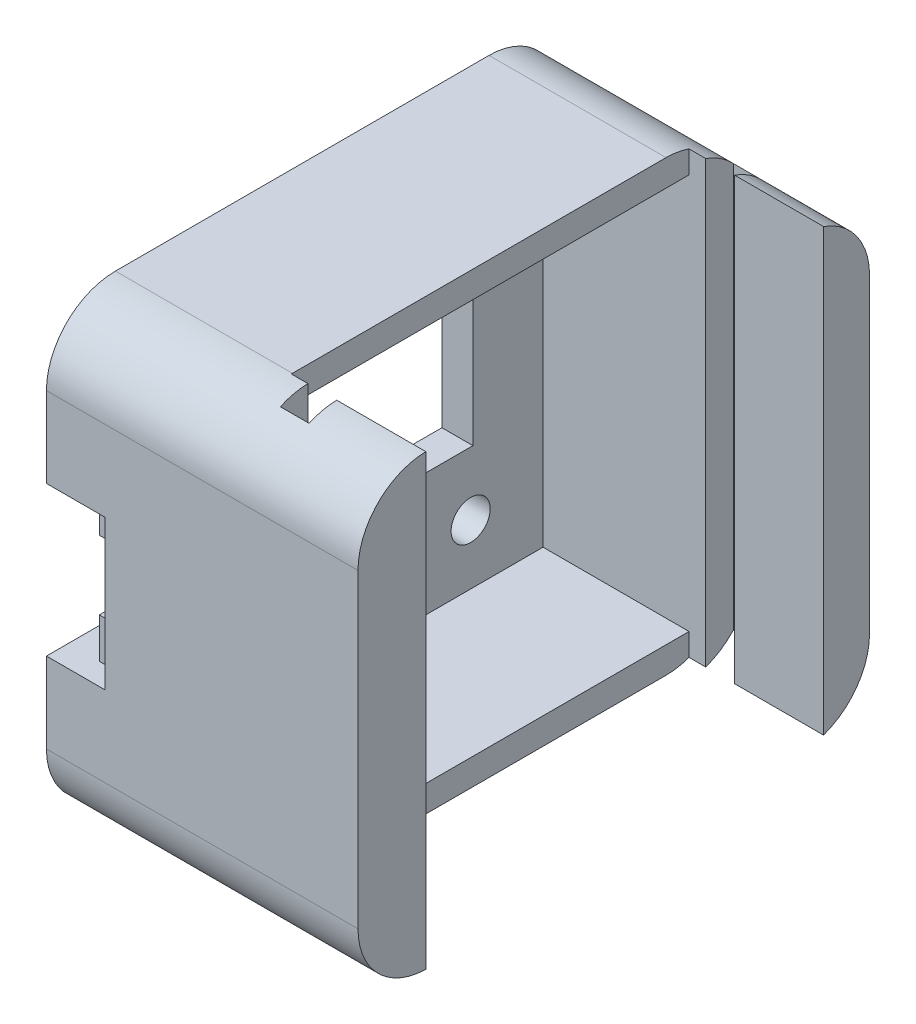
from build123d import *

# Parameters (mm, degrees)
SKETCH1_W           = 42.6
SKETCH1_H           = 39
BOSS_EXTRUDE1_DEPTH = 2.7
SKETCH2_W           = 42.6
SKETCH2_H           = 2.3
BOSS_EXTRUDE2_DEPTH = 12.7
SKETCH3_W           = 4
SKETCH3_H           = 39
BOSS_EXTRUDE3_DEPTH = 18.4
SKETCH4_R           = 1.7
SKETCH4_W           = 33.2
SKETCH4_H           = 13
CUT_EXTRUDE1_DEPTH  = 2.7
SKETCH5_W           = 4.7
SKETCH5_H           = 6
CUT_EXTRUDE2_DEPTH  = 2.4
SKETCH6_W           = 2.5
SKETCH6_H           = 2.4
CUT_EXTRUDE3_DEPTH  = 30
SKETCH7_W           = 5.9
SKETCH7_H           = 39
SKETCH7_W_2         = 4
BOSS_EXTRUDE4_DEPTH = 6
BOSS_EXTRUDE5_DEPTH = 1.9
CUT_EXTRUDE4_DEPTH  = 326.914559356


with BuildPart() as part:
    # Sketch1 → Boss-Extrude1 (new body)
    with BuildSketch(Plane(origin=(193.9, 0, 0), x_dir=(0, 0, -1), z_dir=(1, 0, 0))):
        with Locations((-301, 0)):
            Rectangle(SKETCH1_W, SKETCH1_H)
    extrude(amount=BOSS_EXTRUDE1_DEPTH)

    # Sketch2 → Boss-Extrude2 (add)
    with BuildSketch(Plane(origin=(196.6, 0, 0), x_dir=(0, 0, -1), z_dir=(1, 0, 0))):
        with Locations((-301, 18.35)):
            Rectangle(SKETCH2_W, SKETCH2_H)
        with Locations((-301, -18.35)):
            Rectangle(SKETCH2_W, SKETCH2_H)
    extrude(amount=BOSS_EXTRUDE2_DEPTH)

    # Sketch3 → Boss-Extrude3 (add)
    with BuildSketch(Plane(origin=(196.6, 0, 0), x_dir=(0, 0, -1), z_dir=(1, 0, 0))):
        with Locations((-320.3, 0)):
            Rectangle(SKETCH3_W, SKETCH3_H)
        with Locations((-281.7, 0)):
            Rectangle(SKETCH3_W, SKETCH3_H)
    extrude(amount=BOSS_EXTRUDE3_DEPTH)

    # Sketch4 → Cut-Extrude1 (cut)
    with BuildSketch(Plane(origin=(193.9, 0, 0), x_dir=(0, 0, -1), z_dir=(1, 0, 0))):
        with Locations(Location((-290, 12, 0), (0, 0, 180))):
            Circle(SKETCH4_R)
        with Locations(Location((-290, -12, 0), (0, 0, 180))):
            Circle(SKETCH4_R)
        with Locations(Location((-312, 12, 0), (0, 0, 180))):
            Circle(SKETCH4_R)
        with Locations(Location((-312, -12, 0), (0, 0, 180))):
            Circle(SKETCH4_R)
        with Locations((-306.4, 0)):
            Rectangle(SKETCH4_W, SKETCH4_H)
    extrude(amount=CUT_EXTRUDE1_DEPTH, mode=Mode.SUBTRACT)

    # Sketch5 → Cut-Extrude2 (cut)
    with BuildSketch(Plane(origin=(196.6, 0, 0), x_dir=(0, 0, -1), z_dir=(1, 0, 0))):
        with Locations((-320.65, 0)):
            Rectangle(SKETCH5_W, SKETCH5_H)
    extrude(amount=CUT_EXTRUDE2_DEPTH, mode=Mode.SUBTRACT)

    # Sketch6 → Cut-Extrude3 (cut, symmetric)
    with BuildSketch(Plane(origin=(0, 0, 0), x_dir=(1, 0, 0), z_dir=(0, 1, 0))):
        with Locations((212, -319.5)):
            Rectangle(SKETCH6_W, SKETCH6_H)
        with Locations((212, -282.5)):
            Rectangle(SKETCH6_W, SKETCH6_H)
    extrude(amount=CUT_EXTRUDE3_DEPTH, both=True, mode=Mode.SUBTRACT)

    # Sketch7 → Boss-Extrude4 (add)
    with BuildSketch(Plane(origin=(215, 0, 0), x_dir=(0, 0, -1), z_dir=(1, 0, 0))):
        with Locations((-321.25, 0)):
            Rectangle(SKETCH7_W, SKETCH7_H)
        with Locations((-281.7, 0)):
            Rectangle(SKETCH7_W_2, SKETCH7_H)
    extrude(amount=BOSS_EXTRUDE4_DEPTH)

    # Sketch8 → Boss-Extrude5 (add)
    with BuildSketch(Plane.XY.offset(322.3)):
        Polygon((193.9, -19.5), (215, -19.5), (215, 19.5), (193.9, 19.5), (193.9, 6.5), (199, 6.5), (199, -6.5), (193.9, -6.5), align=None)
    extrude(amount=BOSS_EXTRUDE5_DEPTH)

    # Sketch9 → Cut-Extrude4 (cut, through all)
    with BuildSketch(Plane(origin=(193.9, 0, 0), x_dir=(0, 0, -1), z_dir=(1, 0, 0))):
        with BuildLine():
            Line((-324.2, 13.5), (-325.5, 13.5))
            Line((-325.5, 13.5), (-325.5, 20.5))
            Line((-325.5, 20.5), (-318.2, 20.5))
            Line((-318.2, 20.5), (-318.2, 19.5))
            ThreePointArc((-318.2, 19.5), (-322.442640687, 17.742640687), (-324.2, 13.5))
        make_face()
        with BuildLine():
            Line((-324.2, -13.5), (-325.5, -13.5))
            Line((-325.5, -13.5), (-325.5, -20.5))
            Line((-325.5, -20.5), (-318.2, -20.5))
            Line((-318.2, -20.5), (-318.2, -19.5))
            ThreePointArc((-318.2, -19.5), (-322.442640687, -17.742640687), (-324.2, -13.5))
        make_face()
        with BuildLine():
            Line((-279.7, 13.5), (-278.4, 13.5))
            Line((-278.4, 13.5), (-278.4, 20.5))
            Line((-278.4, 20.5), (-285.7, 20.5))
            Line((-285.7, 20.5), (-285.7, 19.5))
            ThreePointArc((-285.7, 19.5), (-281.457359313, 17.742640687), (-279.7, 13.5))
        make_face()
        with BuildLine():
            Line((-279.7, -13.5), (-278.4, -13.5))
            Line((-278.4, -13.5), (-278.4, -20.5))
            Line((-278.4, -20.5), (-285.7, -20.5))
            Line((-285.7, -20.5), (-285.7, -19.5))
            ThreePointArc((-285.7, -19.5), (-281.457359313, -17.742640687), (-279.7, -13.5))
        make_face()
    extrude(amount=CUT_EXTRUDE4_DEPTH, mode=Mode.SUBTRACT)


solid = part.part
